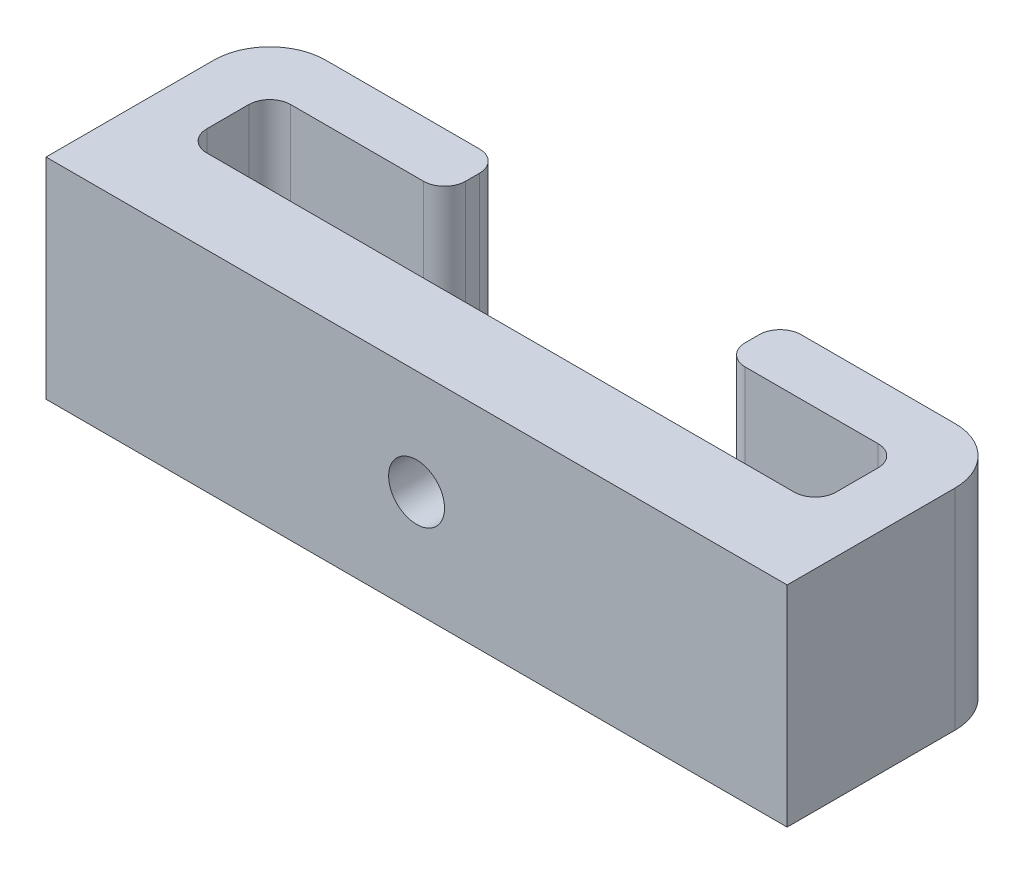
from build123d import *

# Parameters (mm, degrees)
EXTRU_MINCE1_DEPTH                             = 7.5
ESQUISSE4_W                                    = 53
ESQUISSE4_H                                    = 15
BOSS_EXTRU_1_DEPTH                             = 2
FRAISAGE_POUR_VIS_T_TE_FRAIS_E_M41_D           = 4
FRAISAGE_POUR_VIS_T_TE_FRAIS_E_M41_CSINK_D     = 8
FRAISAGE_POUR_VIS_T_TE_FRAIS_E_M41_CSINK_ANGLE = 90
CONG_1_R                                       = 1.5
CONG_2_R                                       = 4


with BuildPart() as part:
    # Esquisse1 → Extru.-Mince1 (new, symmetric)
    with BuildSketch(Plane(origin=(0, 0, 0), x_dir=(1, 0, 0), z_dir=(0, 1, 0))):
        Polygon((-10, 6), (-22.5, 6), (-22.5, 0), (22.5, 0), (22.5, 6), (10, 6), (10, 10), (26.5, 10), (26.5, -4), (-26.5, -4), (-26.5, 10), (-10, 10), align=None)
    extrude(amount=EXTRU_MINCE1_DEPTH, both=True)

    # Esquisse4 → Boss.-Extru.1 (add)
    with BuildSketch(Plane.XY.offset(4)):
        Rectangle(ESQUISSE4_W, ESQUISSE4_H)
    extrude(amount=BOSS_EXTRU_1_DEPTH)

    # Fraisage pour vis à tête fraisée M41 (through all)
    with Locations(Plane(origin=(0, 0, 0), x_dir=(-1, 0, 0), z_dir=(0, 0, -1))):
        with Locations((0, 0)):
            CounterSinkHole(FRAISAGE_POUR_VIS_T_TE_FRAIS_E_M41_D / 2, FRAISAGE_POUR_VIS_T_TE_FRAIS_E_M41_CSINK_D / 2, counter_sink_angle=FRAISAGE_POUR_VIS_T_TE_FRAIS_E_M41_CSINK_ANGLE)

    # Congé1
    cong_1_edges = [part.edges().sort_by_distance(p)[0] for p in [
        (-22.5, 0, -6),
        (-22.5, 0, 0),
        (22.5, 0, 0),
        (22.5, 0, -6),
        (10, 0, -6),
        (10, 0, -10),
        (-10, 0, -10),
        (-10, 0, -6),
    ]]
    fillet(cong_1_edges, radius=CONG_1_R)

    # Congé2
    cong_2_edges = [part.edges().sort_by_distance(p)[0] for p in [
        (26.5, 0, -10),
        (-26.5, 0, -10),
    ]]
    fillet(cong_2_edges, radius=CONG_2_R)


solid = part.part
